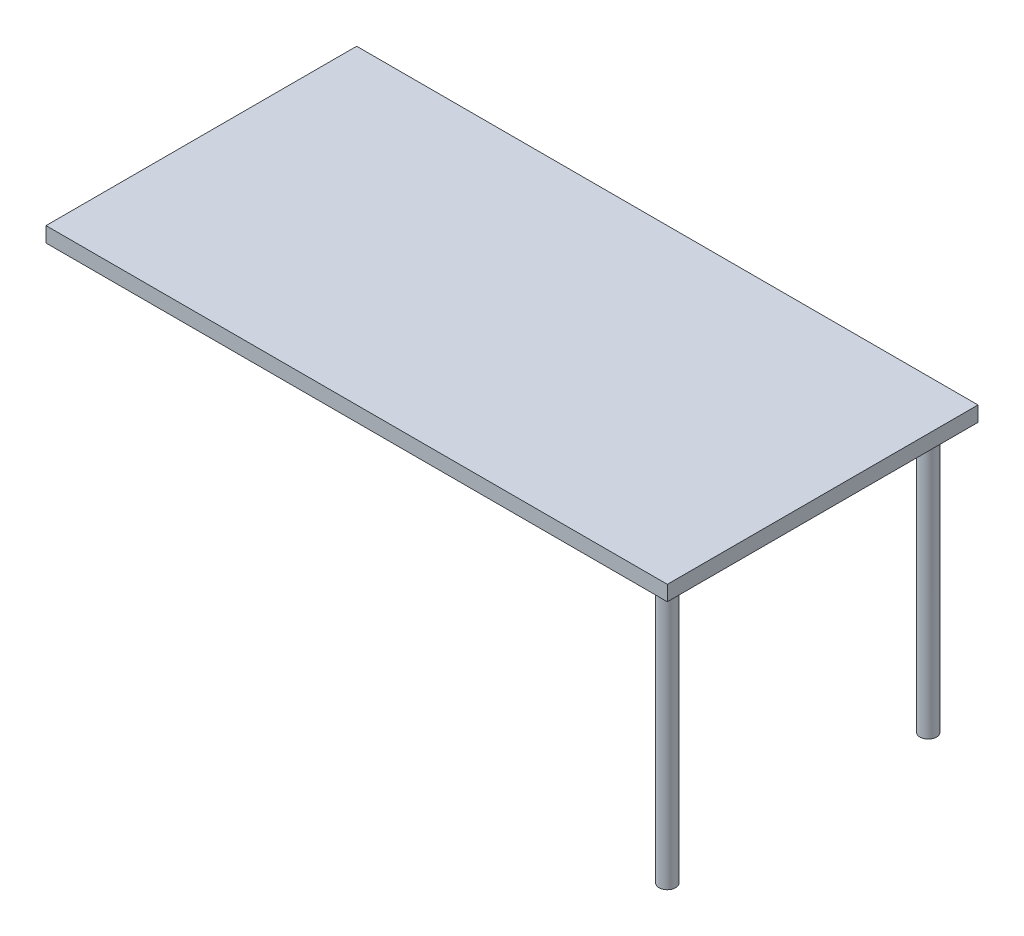
from build123d import *

# Parameters (mm, degrees)
SKETCH1_W           = 1500
SKETCH1_H           = 750
BOSS_EXTRUDE1_DEPTH = 36.5
SKETCH2_R           = 20
BOSS_EXTRUDE2_DEPTH = 648


with BuildPart() as part:
    # Sketch1 → Boss-Extrude1 (new body)
    with BuildSketch(Plane(origin=(0, 0, 0), x_dir=(1, 0, 0), z_dir=(0, 1, 0))):
        Rectangle(SKETCH1_W, SKETCH1_H)
    extrude(amount=BOSS_EXTRUDE1_DEPTH)

    # Sketch2 → Boss-Extrude2 (add)
    with BuildSketch(Plane.XZ):
        with Locations(Location((690, 315, 0), (0, 0, 270))):
            Circle(SKETCH2_R)
    boss_extrude2 = extrude(amount=BOSS_EXTRUDE2_DEPTH)

    # Mirror1: Boss-Extrude2 across plane
    add(boss_extrude2.mirror(Plane.XY))


solid = part.part
